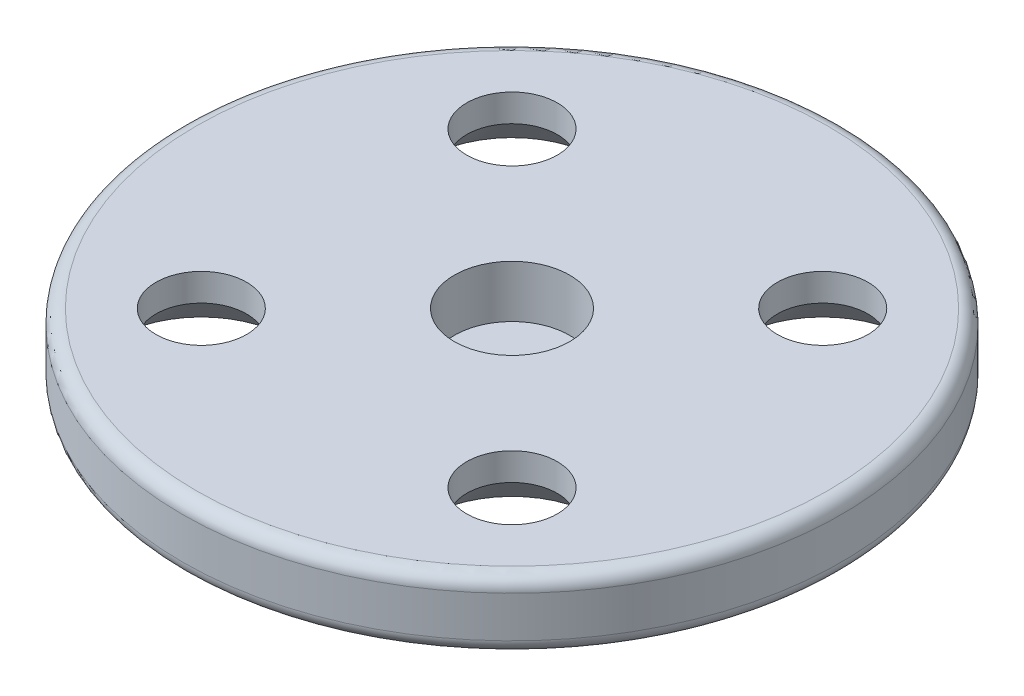
from build123d import *

# Parameters (mm, degrees)
SKETCH1_R           = 12
SKETCH1_R_2         = 1.65
BOSS_EXTRUDE1_DEPTH = 2.5
SKETCH2_R           = 2.1
CUT_EXTRUDE1_DEPTH  = 1.9
CHAMFER1_SIZE       = 1.5
FILLET1_R           = 0.5


with BuildPart() as part:
    # Sketch1 → Boss-Extrude1 (new body)
    with BuildSketch(Plane(origin=(0, 0, 0), x_dir=(1, 0, 0), z_dir=(0, 1, 0))):
        with Locations(Location((0, 0, 0), (0, 0, 270))):
            Circle(SKETCH1_R)
        with Locations(Location((-5.656854249, 5.656854249, 0), (0, 0, 270))):
            Circle(SKETCH1_R_2, mode=Mode.SUBTRACT)
        with Locations(Location((5.656854249, 5.656854249, 0), (0, 0, 270))):
            Circle(SKETCH1_R_2, mode=Mode.SUBTRACT)
        with Locations(Location((5.656854249, -5.656854249, 0), (0, 0, 270))):
            Circle(SKETCH1_R_2, mode=Mode.SUBTRACT)
        with Locations(Location((-5.656854249, -5.656854249, 0), (0, 0, 270))):
            Circle(SKETCH1_R_2, mode=Mode.SUBTRACT)
    extrude(amount=BOSS_EXTRUDE1_DEPTH)

    # Sketch2 → Cut-Extrude1 (cut)
    with BuildSketch(Plane(origin=(0, 2.5, 0), x_dir=(1, 0, 0), z_dir=(0, 1, 0))):
        with Locations(Location((0, 0, 0), (0, 0, 270))):
            Circle(SKETCH2_R)
    extrude(amount=-CUT_EXTRUDE1_DEPTH, mode=Mode.SUBTRACT)

    # Chamfer1
    chamfer1_edges = [part.edges().sort_by_distance(p)[0] for p in [
        (5.656854249, 0, 4.006854249),
        (-5.656854249, 0, 4.006854249),
        (-5.656854249, 0, -7.306854249),
        (5.656854249, 0, -7.306854249),
    ]]
    chamfer(chamfer1_edges, length=CHAMFER1_SIZE)

    # Fillet1
    fillet1_edges = [part.edges().sort_by_distance(p)[0] for p in [
        (0, 0, -12),
        (0, 2.5, -12),
    ]]
    fillet(fillet1_edges, radius=FILLET1_R)


solid = part.part
